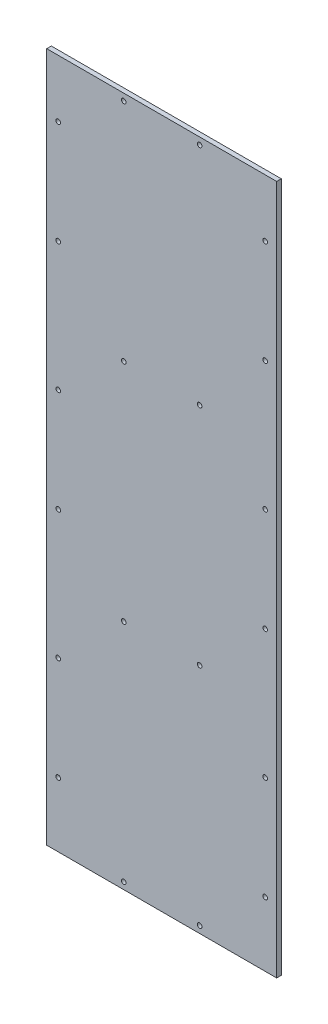
from build123d import *

# Parameters (mm, degrees)
SKETCH1_W           = 100
SKETCH1_H           = 300
BOSS_EXTRUDE1_DEPTH = 2
SKETCH2_R           = 1
CUT_EXTRUDE1_DEPTH  = 25


with BuildPart() as part:
    # Sketch1 → Boss-Extrude1 (new body)
    with BuildSketch(Plane.XY):
        Rectangle(SKETCH1_W, SKETCH1_H)
    extrude(amount=BOSS_EXTRUDE1_DEPTH)

    # Sketch2 → Cut-Extrude1 (cut)
    with BuildSketch(Plane.XY.offset(2)):
        with Locations((-45, 125)):
            Circle(SKETCH2_R)
        with Locations((-45, 80)):
            Circle(SKETCH2_R)
        with Locations((45, 125)):
            Circle(SKETCH2_R)
        with Locations((45, 80)):
            Circle(SKETCH2_R)
        with Locations((-45, 24)):
            Circle(SKETCH2_R)
        with Locations((-45, -21)):
            Circle(SKETCH2_R)
        with Locations((45, 24)):
            Circle(SKETCH2_R)
        with Locations((45, -21)):
            Circle(SKETCH2_R)
        with Locations((-45, -77)):
            Circle(SKETCH2_R)
        with Locations((-45, -122)):
            Circle(SKETCH2_R)
        with Locations((45, -77)):
            Circle(SKETCH2_R)
        with Locations((45, -122)):
            Circle(SKETCH2_R)
        with Locations((16.5, -147)):
            Circle(SKETCH2_R)
        with Locations((-16.5, -147)):
            Circle(SKETCH2_R)
        with Locations((-16.5, -49)):
            Circle(SKETCH2_R)
        with Locations((16.5, -49)):
            Circle(SKETCH2_R)
        with Locations((-16.5, 49)):
            Circle(SKETCH2_R)
        with Locations((16.5, 49)):
            Circle(SKETCH2_R)
        with Locations((-16.5, 147)):
            Circle(SKETCH2_R)
        with Locations((16.5, 147)):
            Circle(SKETCH2_R)
    extrude(amount=-CUT_EXTRUDE1_DEPTH, mode=Mode.SUBTRACT)


solid = part.part
